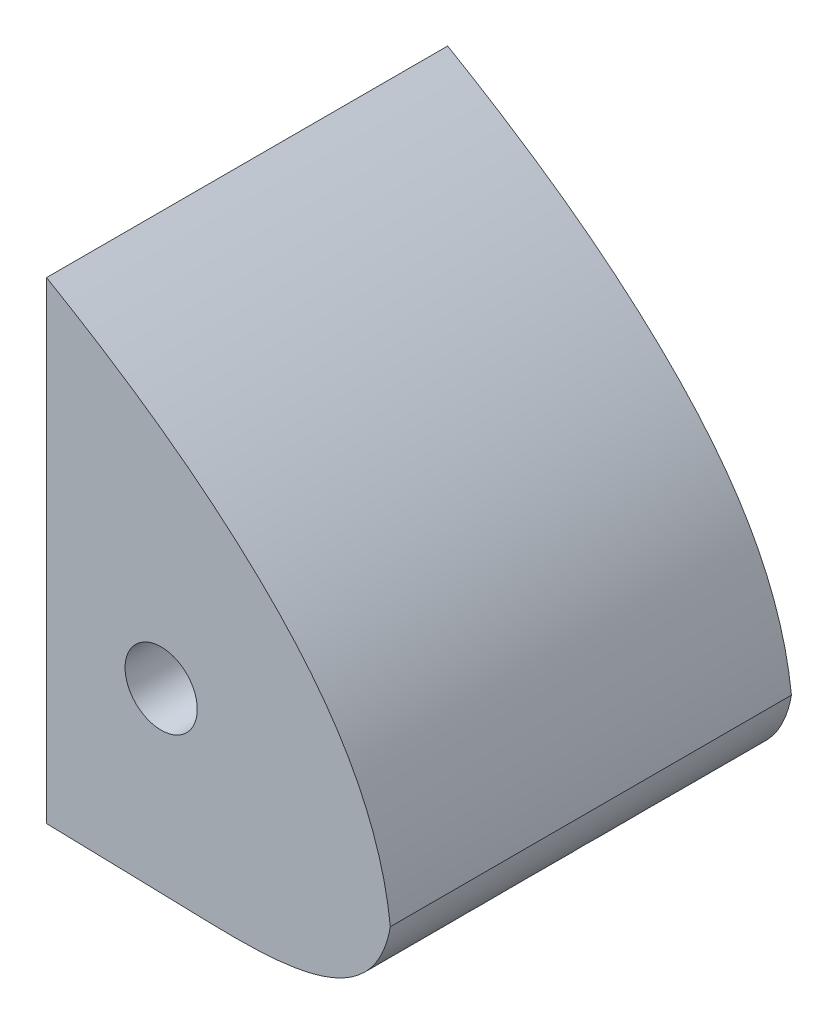
from build123d import *

# Parameters (mm, degrees)
SKETCH1_R           = 2
SKETCH1_R_2         = 2.127
BOSS_EXTRUDE1_DEPTH = 22.225
SKETCH2_W           = 134.292636257
SKETCH2_H           = 53.36276468
CUT_EXTRUDE1_DEPTH  = 28.956


with BuildPart() as part:
    # Sketch1 → Boss-Extrude1 (new body)
    with BuildSketch(Plane.XY):
        with BuildLine():
            Line((-66.006971629, 14.952323969), (-66.006971629, -5.634708623))
            add(Edge.make_bspline(
                [(-66.006971629, -5.634708623), (-44.594037188, -5.53917688), (-13.013022308, -6.724098502), (26.136656569, -12.750856754), (48.765267423, -16.900764204), (64.683362663, -16.969052393), (75.290630493, -17.522529218), (76.216996263, -12.308293591)],
                knots=[0.133250972, 0.133250972, 0.133250972, 0.133250972, 0.517329722, 0.696666541, 0.849409938, 0.919519723, 1, 1, 1, 1], degree=3))
            add(Edge.make_bspline(
                [(76.216996263, -12.308293591), (75.606952539, -6.766559658), (69.704300689, 1.138389205), (56.422236631, 10.264383598), (36.976103105, 19.370772836), (8.741687209, 24.815403957), (-27.455234983, 23.566672909), (-52.387628688, 18.103631651), (-66.006971629, 14.952323969)],
                knots=[0, 0, 0, 0, 0.086586993, 0.161737428, 0.268322265, 0.445156627, 0.638028873, 0.872370876, 0.872370876, 0.872370876, 0.872370876], degree=3))
        make_face()
        with Locations((63.516996263, -7.228293591)):
            Circle(SKETCH1_R, mode=Mode.SUBTRACT)
        with Locations((-25.383003737, 13.091706409)):
            Circle(SKETCH1_R_2, mode=Mode.SUBTRACT)
    extrude(amount=BOSS_EXTRUDE1_DEPTH)

    # Sketch2 → Cut-Extrude1 (cut)
    with BuildSketch(Plane.XY.offset(22.225)):
        with Locations((-9.979321866, 4.011118028)):
            Rectangle(SKETCH2_W, SKETCH2_H)
    extrude(amount=-CUT_EXTRUDE1_DEPTH, mode=Mode.SUBTRACT)


solid = part.part
